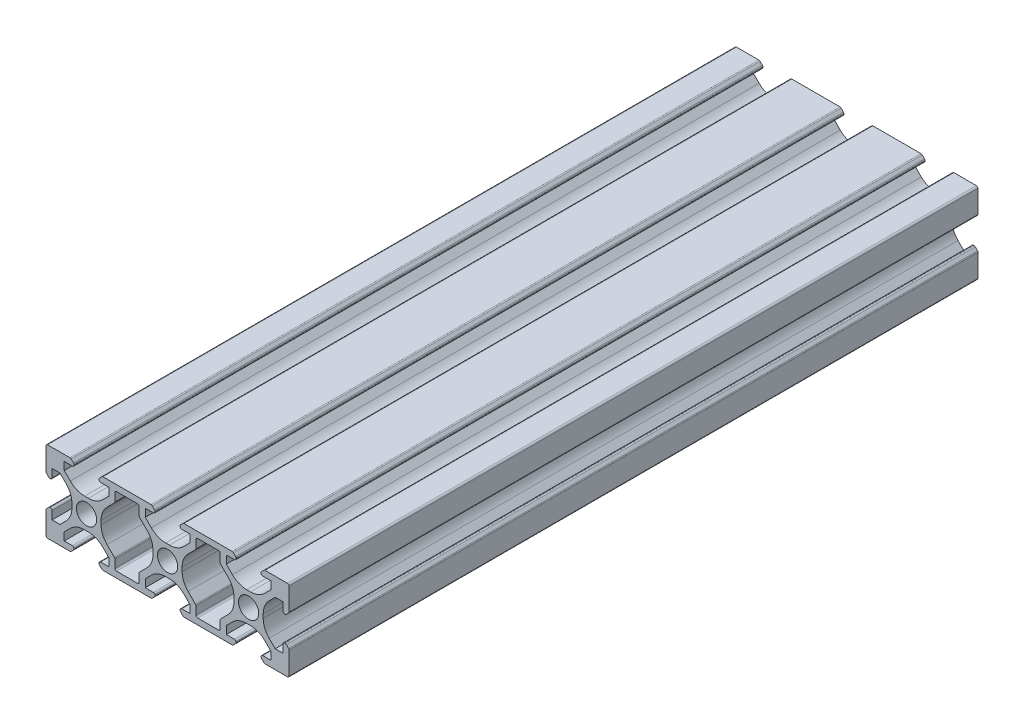
from build123d import *

# Parameters (mm, degrees)
RESSALTO_EXTRUS_O1_DEPTH    = 170
PADR_OCIRCULAR1_COUNT       = 4
PADR_O_LINEAR1_COUNT        = 3
PADR_O_LINEAR1_PITCH        = 20
PADR_O_LINEAR1_COPY_1_DEPTH = 170
PADR_O_LINEAR1_COPY_2_DEPTH = 170
PADR_O_LINEAR1_COPY_3_DEPTH = 170
PADR_O_LINEAR1_COPY_4_DEPTH = 170
PADR_O_LINEAR1_COPY_5_DEPTH = 170
PADR_O_LINEAR1_COPY_6_DEPTH = 170
CORTE_EXTRUS_O1_DEPTH       = 178.482393493
PADR_O_LINEAR2_COUNT        = 2
PADR_O_LINEAR2_PITCH        = 20
FILETE1_R                   = 0.4
FILETE2_R                   = 0.4


with BuildPart() as part:
    # Esboço1 → Ressalto-extrusão1 (new body)
    with BuildSketch(Plane.XY):
        with BuildLine():
            ThreePointArc((-9.317157288, 3.217157288), (-9.187387948, 3.130448187), (-9.034314575, 3.1))
            Line((-9.034314575, 3.1), (-8.9, 3.1))
            ThreePointArc((-8.9, 3.1), (-8.617157288, 3.217157288), (-8.5, 3.5))
            Line((-8.5, 3.5), (-8.5, 5.5))
            Line((-8.5, 5.5), (-6.560660172, 5.5))
            Line((-6.560660172, 5.5), (-5.064466094, 4.003805922))
            ThreePointArc((-5.064466094, 4.003805922), (-3.980602337, 2.381689178), (-3.6, 0.468272016))
            Line((-3.6, 0.468272016), (-3.6, 0))
            Line((-3.6, 0), (-2.5, 0))
            ThreePointArc((-2.5, 0), (-1.767766953, 1.767766953), (0, 2.5))
            Line((0, 2.5), (0, 3.6))
            Line((0, 3.6), (-0.468272016, 3.6))
            ThreePointArc((-0.468272016, 3.6), (-2.381689178, 3.980602337), (-4.003805922, 5.064466094))
            Line((-4.003805922, 5.064466094), (-5.5, 6.560660172))
            Line((-5.5, 6.560660172), (-5.5, 8.5))
            Line((-5.5, 8.5), (-3.5, 8.5))
            ThreePointArc((-3.5, 8.5), (-3.217157288, 8.617157288), (-3.1, 8.9))
            Line((-3.1, 8.9), (-3.1, 9.034314575))
            ThreePointArc((-3.1, 9.034314575), (-3.130448187, 9.187387948), (-3.217157288, 9.317157288))
            Line((-3.217157288, 9.317157288), (-3.782842712, 9.882842712))
            ThreePointArc((-3.782842712, 9.882842712), (-3.912612052, 9.969551813), (-4.065685425, 10))
            Line((-4.065685425, 10), (-10, 10))
            Line((-10, 10), (-10, 4.065685425))
            ThreePointArc((-10, 4.065685425), (-9.969551813, 3.912612052), (-9.882842712, 3.782842712))
            Line((-9.882842712, 3.782842712), (-9.317157288, 3.217157288))
        make_face()
    ressalto_extrus_o1 = extrude(amount=RESSALTO_EXTRUS_O1_DEPTH)

    # PadrãoCircular1: Ressalto-extrusão1 ×4 about axis
    padr_ocircular1_axis = Axis((0, 0, 0), (0, 0, 1))
    for i in range(1, PADR_OCIRCULAR1_COUNT):
        add(ressalto_extrus_o1.rotate(padr_ocircular1_axis, i * 360 / PADR_OCIRCULAR1_COUNT))

    # Padrão linear1: Ressalto-extrusão1 ×3
    with Locations(*[(i * PADR_O_LINEAR1_PITCH, 0, 0) for i in range(1, PADR_O_LINEAR1_COUNT)]):
        add(ressalto_extrus_o1)

    # Padrão linear1 copy 1 sketch → Padrão linear1 copy 1 (add)
    with BuildSketch(Plane(origin=(20, 0, 0), x_dir=(0, 1, 0), z_dir=(0, 0, 1))):
        with BuildLine():
            ThreePointArc((-9.317157288, 3.217157288), (-9.187387948, 3.130448187), (-9.034314575, 3.1))
            Line((-9.034314575, 3.1), (-8.9, 3.1))
            ThreePointArc((-8.9, 3.1), (-8.617157288, 3.217157288), (-8.5, 3.5))
            Line((-8.5, 3.5), (-8.5, 5.5))
            Line((-8.5, 5.5), (-6.560660172, 5.5))
            Line((-6.560660172, 5.5), (-5.064466094, 4.003805922))
            ThreePointArc((-5.064466094, 4.003805922), (-3.980602337, 2.381689178), (-3.6, 0.468272016))
            Line((-3.6, 0.468272016), (-3.6, 0))
            Line((-3.6, 0), (-2.5, 0))
            ThreePointArc((-2.5, 0), (-1.767766953, 1.767766953), (0, 2.5))
            Line((0, 2.5), (0, 3.6))
            Line((0, 3.6), (-0.468272016, 3.6))
            ThreePointArc((-0.468272016, 3.6), (-2.381689178, 3.980602337), (-4.003805922, 5.064466094))
            Line((-4.003805922, 5.064466094), (-5.5, 6.560660172))
            Line((-5.5, 6.560660172), (-5.5, 8.5))
            Line((-5.5, 8.5), (-3.5, 8.5))
            ThreePointArc((-3.5, 8.5), (-3.217157288, 8.617157288), (-3.1, 8.9))
            Line((-3.1, 8.9), (-3.1, 9.034314575))
            ThreePointArc((-3.1, 9.034314575), (-3.130448187, 9.187387948), (-3.217157288, 9.317157288))
            Line((-3.217157288, 9.317157288), (-3.782842712, 9.882842712))
            ThreePointArc((-3.782842712, 9.882842712), (-3.912612052, 9.969551813), (-4.065685425, 10))
            Line((-4.065685425, 10), (-10, 10))
            Line((-10, 10), (-10, 4.065685425))
            ThreePointArc((-10, 4.065685425), (-9.969551813, 3.912612052), (-9.882842712, 3.782842712))
            Line((-9.882842712, 3.782842712), (-9.317157288, 3.217157288))
        make_face()
    extrude(amount=PADR_O_LINEAR1_COPY_1_DEPTH)

    # Padrão linear1 copy 2 sketch → Padrão linear1 copy 2 (add)
    with BuildSketch(Plane(origin=(40, 0, 0), x_dir=(0, 1, 0), z_dir=(0, 0, 1))):
        with BuildLine():
            ThreePointArc((-9.317157288, 3.217157288), (-9.187387948, 3.130448187), (-9.034314575, 3.1))
            Line((-9.034314575, 3.1), (-8.9, 3.1))
            ThreePointArc((-8.9, 3.1), (-8.617157288, 3.217157288), (-8.5, 3.5))
            Line((-8.5, 3.5), (-8.5, 5.5))
            Line((-8.5, 5.5), (-6.560660172, 5.5))
            Line((-6.560660172, 5.5), (-5.064466094, 4.003805922))
            ThreePointArc((-5.064466094, 4.003805922), (-3.980602337, 2.381689178), (-3.6, 0.468272016))
            Line((-3.6, 0.468272016), (-3.6, 0))
            Line((-3.6, 0), (-2.5, 0))
            ThreePointArc((-2.5, 0), (-1.767766953, 1.767766953), (0, 2.5))
            Line((0, 2.5), (0, 3.6))
            Line((0, 3.6), (-0.468272016, 3.6))
            ThreePointArc((-0.468272016, 3.6), (-2.381689178, 3.980602337), (-4.003805922, 5.064466094))
            Line((-4.003805922, 5.064466094), (-5.5, 6.560660172))
            Line((-5.5, 6.560660172), (-5.5, 8.5))
            Line((-5.5, 8.5), (-3.5, 8.5))
            ThreePointArc((-3.5, 8.5), (-3.217157288, 8.617157288), (-3.1, 8.9))
            Line((-3.1, 8.9), (-3.1, 9.034314575))
            ThreePointArc((-3.1, 9.034314575), (-3.130448187, 9.187387948), (-3.217157288, 9.317157288))
            Line((-3.217157288, 9.317157288), (-3.782842712, 9.882842712))
            ThreePointArc((-3.782842712, 9.882842712), (-3.912612052, 9.969551813), (-4.065685425, 10))
            Line((-4.065685425, 10), (-10, 10))
            Line((-10, 10), (-10, 4.065685425))
            ThreePointArc((-10, 4.065685425), (-9.969551813, 3.912612052), (-9.882842712, 3.782842712))
            Line((-9.882842712, 3.782842712), (-9.317157288, 3.217157288))
        make_face()
    extrude(amount=PADR_O_LINEAR1_COPY_2_DEPTH)

    # Padrão linear1 copy 3 sketch → Padrão linear1 copy 3 (add)
    with BuildSketch(Plane(origin=(20, 0, 0), x_dir=(-1, 0, 0), z_dir=(0, 0, 1))):
        with BuildLine():
            ThreePointArc((-9.317157288, 3.217157288), (-9.187387948, 3.130448187), (-9.034314575, 3.1))
            Line((-9.034314575, 3.1), (-8.9, 3.1))
            ThreePointArc((-8.9, 3.1), (-8.617157288, 3.217157288), (-8.5, 3.5))
            Line((-8.5, 3.5), (-8.5, 5.5))
            Line((-8.5, 5.5), (-6.560660172, 5.5))
            Line((-6.560660172, 5.5), (-5.064466094, 4.003805922))
            ThreePointArc((-5.064466094, 4.003805922), (-3.980602337, 2.381689178), (-3.6, 0.468272016))
            Line((-3.6, 0.468272016), (-3.6, 0))
            Line((-3.6, 0), (-2.5, 0))
            ThreePointArc((-2.5, 0), (-1.767766953, 1.767766953), (0, 2.5))
            Line((0, 2.5), (0, 3.6))
            Line((0, 3.6), (-0.468272016, 3.6))
            ThreePointArc((-0.468272016, 3.6), (-2.381689178, 3.980602337), (-4.003805922, 5.064466094))
            Line((-4.003805922, 5.064466094), (-5.5, 6.560660172))
            Line((-5.5, 6.560660172), (-5.5, 8.5))
            Line((-5.5, 8.5), (-3.5, 8.5))
            ThreePointArc((-3.5, 8.5), (-3.217157288, 8.617157288), (-3.1, 8.9))
            Line((-3.1, 8.9), (-3.1, 9.034314575))
            ThreePointArc((-3.1, 9.034314575), (-3.130448187, 9.187387948), (-3.217157288, 9.317157288))
            Line((-3.217157288, 9.317157288), (-3.782842712, 9.882842712))
            ThreePointArc((-3.782842712, 9.882842712), (-3.912612052, 9.969551813), (-4.065685425, 10))
            Line((-4.065685425, 10), (-10, 10))
            Line((-10, 10), (-10, 4.065685425))
            ThreePointArc((-10, 4.065685425), (-9.969551813, 3.912612052), (-9.882842712, 3.782842712))
            Line((-9.882842712, 3.782842712), (-9.317157288, 3.217157288))
        make_face()
    extrude(amount=PADR_O_LINEAR1_COPY_3_DEPTH)

    # Padrão linear1 copy 4 sketch → Padrão linear1 copy 4 (add)
    with BuildSketch(Plane(origin=(40, 0, 0), x_dir=(-1, 0, 0), z_dir=(0, 0, 1))):
        with BuildLine():
            ThreePointArc((-9.317157288, 3.217157288), (-9.187387948, 3.130448187), (-9.034314575, 3.1))
            Line((-9.034314575, 3.1), (-8.9, 3.1))
            ThreePointArc((-8.9, 3.1), (-8.617157288, 3.217157288), (-8.5, 3.5))
            Line((-8.5, 3.5), (-8.5, 5.5))
            Line((-8.5, 5.5), (-6.560660172, 5.5))
            Line((-6.560660172, 5.5), (-5.064466094, 4.003805922))
            ThreePointArc((-5.064466094, 4.003805922), (-3.980602337, 2.381689178), (-3.6, 0.468272016))
            Line((-3.6, 0.468272016), (-3.6, 0))
            Line((-3.6, 0), (-2.5, 0))
            ThreePointArc((-2.5, 0), (-1.767766953, 1.767766953), (0, 2.5))
            Line((0, 2.5), (0, 3.6))
            Line((0, 3.6), (-0.468272016, 3.6))
            ThreePointArc((-0.468272016, 3.6), (-2.381689178, 3.980602337), (-4.003805922, 5.064466094))
            Line((-4.003805922, 5.064466094), (-5.5, 6.560660172))
            Line((-5.5, 6.560660172), (-5.5, 8.5))
            Line((-5.5, 8.5), (-3.5, 8.5))
            ThreePointArc((-3.5, 8.5), (-3.217157288, 8.617157288), (-3.1, 8.9))
            Line((-3.1, 8.9), (-3.1, 9.034314575))
            ThreePointArc((-3.1, 9.034314575), (-3.130448187, 9.187387948), (-3.217157288, 9.317157288))
            Line((-3.217157288, 9.317157288), (-3.782842712, 9.882842712))
            ThreePointArc((-3.782842712, 9.882842712), (-3.912612052, 9.969551813), (-4.065685425, 10))
            Line((-4.065685425, 10), (-10, 10))
            Line((-10, 10), (-10, 4.065685425))
            ThreePointArc((-10, 4.065685425), (-9.969551813, 3.912612052), (-9.882842712, 3.782842712))
            Line((-9.882842712, 3.782842712), (-9.317157288, 3.217157288))
        make_face()
    extrude(amount=PADR_O_LINEAR1_COPY_4_DEPTH)

    # Padrão linear1 copy 5 sketch → Padrão linear1 copy 5 (add)
    with BuildSketch(Plane(origin=(20, 0, 0), x_dir=(0, -1, 0), z_dir=(0, 0, 1))):
        with BuildLine():
            ThreePointArc((-9.317157288, 3.217157288), (-9.187387948, 3.130448187), (-9.034314575, 3.1))
            Line((-9.034314575, 3.1), (-8.9, 3.1))
            ThreePointArc((-8.9, 3.1), (-8.617157288, 3.217157288), (-8.5, 3.5))
            Line((-8.5, 3.5), (-8.5, 5.5))
            Line((-8.5, 5.5), (-6.560660172, 5.5))
            Line((-6.560660172, 5.5), (-5.064466094, 4.003805922))
            ThreePointArc((-5.064466094, 4.003805922), (-3.980602337, 2.381689178), (-3.6, 0.468272016))
            Line((-3.6, 0.468272016), (-3.6, 0))
            Line((-3.6, 0), (-2.5, 0))
            ThreePointArc((-2.5, 0), (-1.767766953, 1.767766953), (0, 2.5))
            Line((0, 2.5), (0, 3.6))
            Line((0, 3.6), (-0.468272016, 3.6))
            ThreePointArc((-0.468272016, 3.6), (-2.381689178, 3.980602337), (-4.003805922, 5.064466094))
            Line((-4.003805922, 5.064466094), (-5.5, 6.560660172))
            Line((-5.5, 6.560660172), (-5.5, 8.5))
            Line((-5.5, 8.5), (-3.5, 8.5))
            ThreePointArc((-3.5, 8.5), (-3.217157288, 8.617157288), (-3.1, 8.9))
            Line((-3.1, 8.9), (-3.1, 9.034314575))
            ThreePointArc((-3.1, 9.034314575), (-3.130448187, 9.187387948), (-3.217157288, 9.317157288))
            Line((-3.217157288, 9.317157288), (-3.782842712, 9.882842712))
            ThreePointArc((-3.782842712, 9.882842712), (-3.912612052, 9.969551813), (-4.065685425, 10))
            Line((-4.065685425, 10), (-10, 10))
            Line((-10, 10), (-10, 4.065685425))
            ThreePointArc((-10, 4.065685425), (-9.969551813, 3.912612052), (-9.882842712, 3.782842712))
            Line((-9.882842712, 3.782842712), (-9.317157288, 3.217157288))
        make_face()
    extrude(amount=PADR_O_LINEAR1_COPY_5_DEPTH)

    # Padrão linear1 copy 6 sketch → Padrão linear1 copy 6 (add)
    with BuildSketch(Plane(origin=(40, 0, 0), x_dir=(0, -1, 0), z_dir=(0, 0, 1))):
        with BuildLine():
            ThreePointArc((-9.317157288, 3.217157288), (-9.187387948, 3.130448187), (-9.034314575, 3.1))
            Line((-9.034314575, 3.1), (-8.9, 3.1))
            ThreePointArc((-8.9, 3.1), (-8.617157288, 3.217157288), (-8.5, 3.5))
            Line((-8.5, 3.5), (-8.5, 5.5))
            Line((-8.5, 5.5), (-6.560660172, 5.5))
            Line((-6.560660172, 5.5), (-5.064466094, 4.003805922))
            ThreePointArc((-5.064466094, 4.003805922), (-3.980602337, 2.381689178), (-3.6, 0.468272016))
            Line((-3.6, 0.468272016), (-3.6, 0))
            Line((-3.6, 0), (-2.5, 0))
            ThreePointArc((-2.5, 0), (-1.767766953, 1.767766953), (0, 2.5))
            Line((0, 2.5), (0, 3.6))
            Line((0, 3.6), (-0.468272016, 3.6))
            ThreePointArc((-0.468272016, 3.6), (-2.381689178, 3.980602337), (-4.003805922, 5.064466094))
            Line((-4.003805922, 5.064466094), (-5.5, 6.560660172))
            Line((-5.5, 6.560660172), (-5.5, 8.5))
            Line((-5.5, 8.5), (-3.5, 8.5))
            ThreePointArc((-3.5, 8.5), (-3.217157288, 8.617157288), (-3.1, 8.9))
            Line((-3.1, 8.9), (-3.1, 9.034314575))
            ThreePointArc((-3.1, 9.034314575), (-3.130448187, 9.187387948), (-3.217157288, 9.317157288))
            Line((-3.217157288, 9.317157288), (-3.782842712, 9.882842712))
            ThreePointArc((-3.782842712, 9.882842712), (-3.912612052, 9.969551813), (-4.065685425, 10))
            Line((-4.065685425, 10), (-10, 10))
            Line((-10, 10), (-10, 4.065685425))
            ThreePointArc((-10, 4.065685425), (-9.969551813, 3.912612052), (-9.882842712, 3.782842712))
            Line((-9.882842712, 3.782842712), (-9.317157288, 3.217157288))
        make_face()
    extrude(amount=PADR_O_LINEAR1_COPY_6_DEPTH)

    # Esboço4 → Corte-extrusão1 (cut, through all)
    with BuildSketch(Plane(origin=(0, 0, 0), x_dir=(-1, 0, 0), z_dir=(0, 0, -1))):
        Polygon((-13.439339828, 5.5), (-13, 5.939339828), (-13, 8.5), (-7, 8.5), (-7, 5.939339828), (-6.560660172, 5.5), (-6.560660172, -5.5), (-7, -5.939339828), (-7, -8.5), (-13, -8.5), (-13, -5.939339828), (-13.439339828, -5.5), align=None)
    corte_extrus_o1 = extrude(amount=-CORTE_EXTRUS_O1_DEPTH, mode=Mode.SUBTRACT)

    # Padrão linear2: Corte-extrusão1 ×2
    with Locations(*[(i * PADR_O_LINEAR2_PITCH, 0, 0) for i in range(1, PADR_O_LINEAR2_COUNT)]):
        add(corte_extrus_o1, mode=Mode.SUBTRACT)

    # Filete1
    filete1_edges = [part.edges().sort_by_distance(p)[0] for p in [
        (13, 5.939339828, 85),
        (13, 8.5, 85),
        (7, 8.5, 85),
        (7, 5.939339828, 85),
        (7, -5.939339828, 85),
        (7, -8.5, 85),
        (13, -8.5, 85),
        (13, -5.939339828, 85),
        (33, 5.939339828, 85),
        (33, 8.5, 85),
        (27, 8.5, 85),
        (27, 5.939339828, 85),
        (27, -5.939339828, 85),
        (27, -8.5, 85),
        (33, -8.5, 85),
        (33, -5.939339828, 85),
    ]]
    fillet(filete1_edges, radius=FILETE1_R)

    # Filete2
    filete2_edges = [part.edges().sort_by_distance(p)[0] for p in [
        (-10, 10, 85),
        (50, -10, 85),
        (50, 10, 85),
        (-10, -10, 85),
    ]]
    fillet(filete2_edges, radius=FILETE2_R)


solid = part.part
